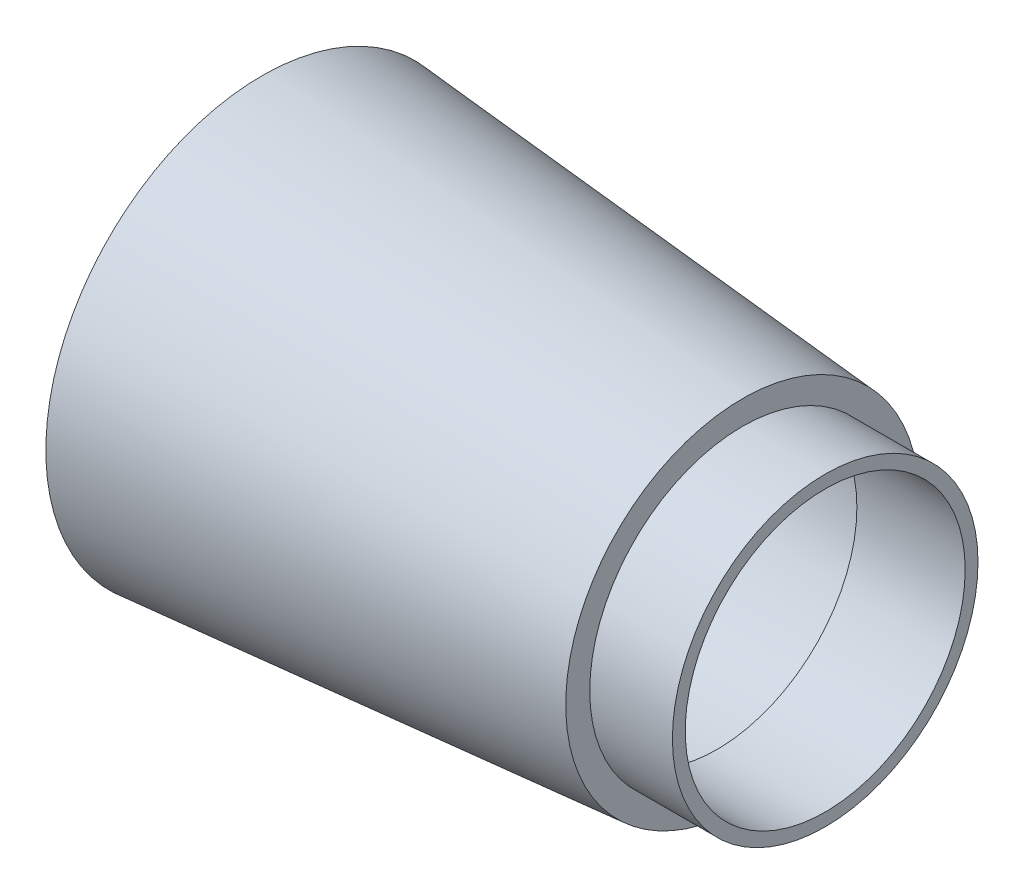
from build123d import *

# Parameters (mm, degrees)
SKETCH2_W      = 0.625748312
SKETCH2_H      = 0.221900722
REVOLVE5_ANGLE = 180


with BuildPart() as part:
    # Sketch1 → Revolve4 (revolve)
    with BuildSketch(Plane.XY, mode=Mode.PRIVATE) as revolve4_sk:
        Polygon((-12.065, 11.43), (-12.065, 10.16), (-1.079269363, 9.259170088), (-1.079269363, 0), (0.635, 0), (0.635, 9.1186), (11.979982671, 8.188311421), (11.979982671, 7.399559782), (17.704559016, 7.399559782), (17.704559016, 8.0772), (13.335, 8.0772), (13.335, 9.3472), align=None)
    revolve(revolve4_sk.sketch.rotate(Axis((44.726440805, 0, 0), (-1, 0, 0)), 90), axis=Axis((44.726440805, 0, 0), (-1, 0, 0)))

    # Sketch2 → Revolve5 (revolve)
    with BuildSketch(Plane(origin=(0.635, 0, 0), x_dir=(0, 0, -1), z_dir=(1, 0, 0))):
        with Locations((0, 0.897225516)):
            Rectangle(SKETCH2_W, SKETCH2_H)
    revolve(axis=Axis((0.635, 0, 0.312874156), (0, 0, -1)), revolution_arc=REVOLVE5_ANGLE)


solid = part.part
